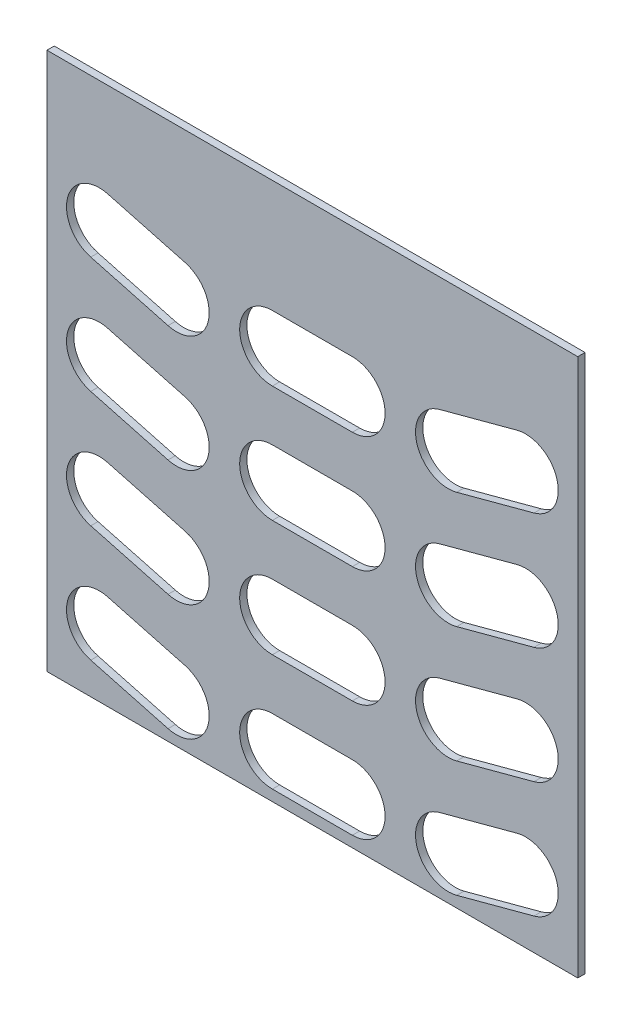
from build123d import *

# Parameters (mm, degrees)
SKETCH1_W          = 36.5
SKETCH1_H          = 37
EXTRUDE1_DEPTH     = 0.5
CUT_EXTRUDE1_DEPTH = 39.591611783
LPATTERN1_COUNT    = 4
LPATTERN1_PITCH    = 8


with BuildPart() as part:
    # Sketch1 → Extrude1 (new body)
    with BuildSketch(Plane.XY):
        with Locations((0, 15.5)):
            Rectangle(SKETCH1_W, SKETCH1_H)
    extrude(amount=EXTRUDE1_DEPTH)

    # Sketch2 → Cut-Extrude1 (cut, through all)
    with BuildSketch(Plane(origin=(0, 0, 0), x_dir=(-1, 0, 0), z_dir=(0, 0, -1))):
        with BuildLine():
            Line((-15.238638874, 23.185419265), (-9.926046829, 21.761914517))
            ThreePointArc((-9.926046829, 21.761914517), (-7.170370869, 23.352904774), (-8.761361126, 26.108580735))
            Line((-8.761361126, 26.108580735), (-14.073953171, 27.532085483))
            ThreePointArc((-14.073953171, 27.532085483), (-16.829629131, 25.941095226), (-15.238638874, 23.185419265))
        make_face()
        with BuildLine():
            Line((-2.75, 21.75), (2.75, 21.75))
            ThreePointArc((2.75, 21.75), (5, 24), (2.75, 26.25))
            Line((2.75, 26.25), (-2.75, 26.25))
            ThreePointArc((-2.75, 26.25), (-5, 24), (-2.75, 21.75))
        make_face()
        with BuildLine():
            Line((9.926046829, 21.761914517), (15.238638874, 23.185419265))
            ThreePointArc((15.238638874, 23.185419265), (16.829629131, 25.941095226), (14.073953171, 27.532085483))
            Line((14.073953171, 27.532085483), (8.761361126, 26.108580735))
            ThreePointArc((8.761361126, 26.108580735), (7.170370869, 23.352904774), (9.926046829, 21.761914517))
        make_face()
    cut_extrude1 = extrude(amount=-CUT_EXTRUDE1_DEPTH, mode=Mode.SUBTRACT)

    # LPattern1: Cut-Extrude1 ×4
    with Locations(*[(0, -i * LPATTERN1_PITCH, 0) for i in range(1, LPATTERN1_COUNT)]):
        add(cut_extrude1, mode=Mode.SUBTRACT)


solid = part.part
